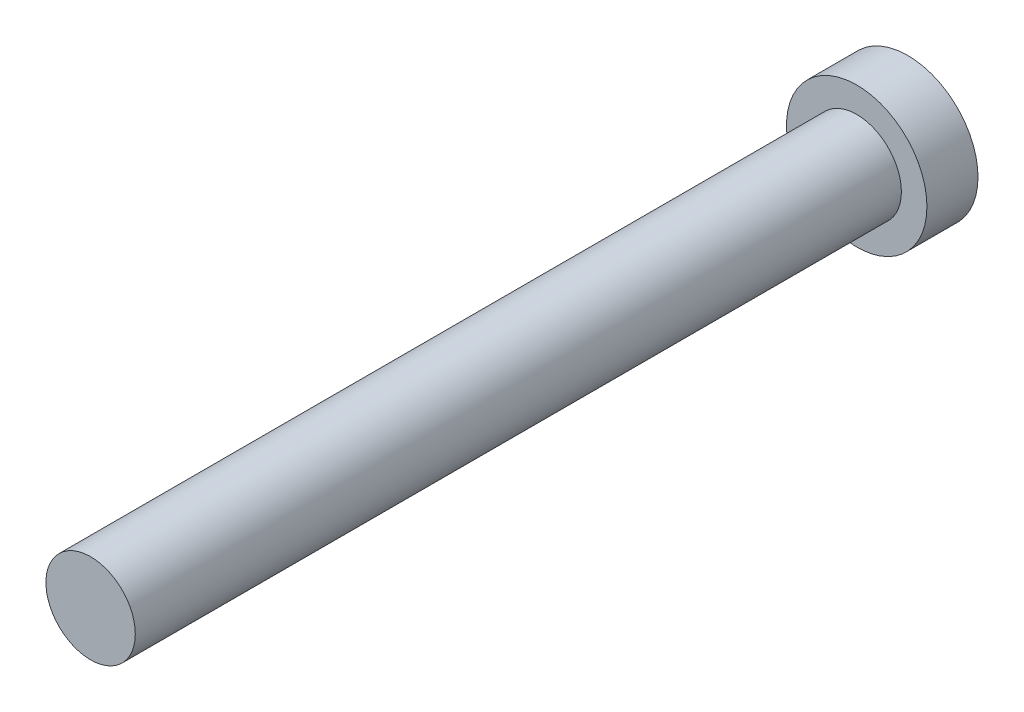
from build123d import *

# Parameters (mm, degrees)
SKETCH_1_R      = 2.75
EXTRUDE_1_DEPTH = 2
SKETCH_2_R      = 1.75
EXTRUDE_2_DEPTH = 30


with BuildPart() as part:
    # 草圖1 → 伸長1 (new body)
    with BuildSketch(Plane.XY):
        Circle(SKETCH_1_R)
    extrude(amount=EXTRUDE_1_DEPTH)

    # 草圖2 → 伸長2 (add)
    with BuildSketch(Plane.XY.offset(2)):
        Circle(SKETCH_2_R)
    extrude(amount=EXTRUDE_2_DEPTH)


solid = part.part
